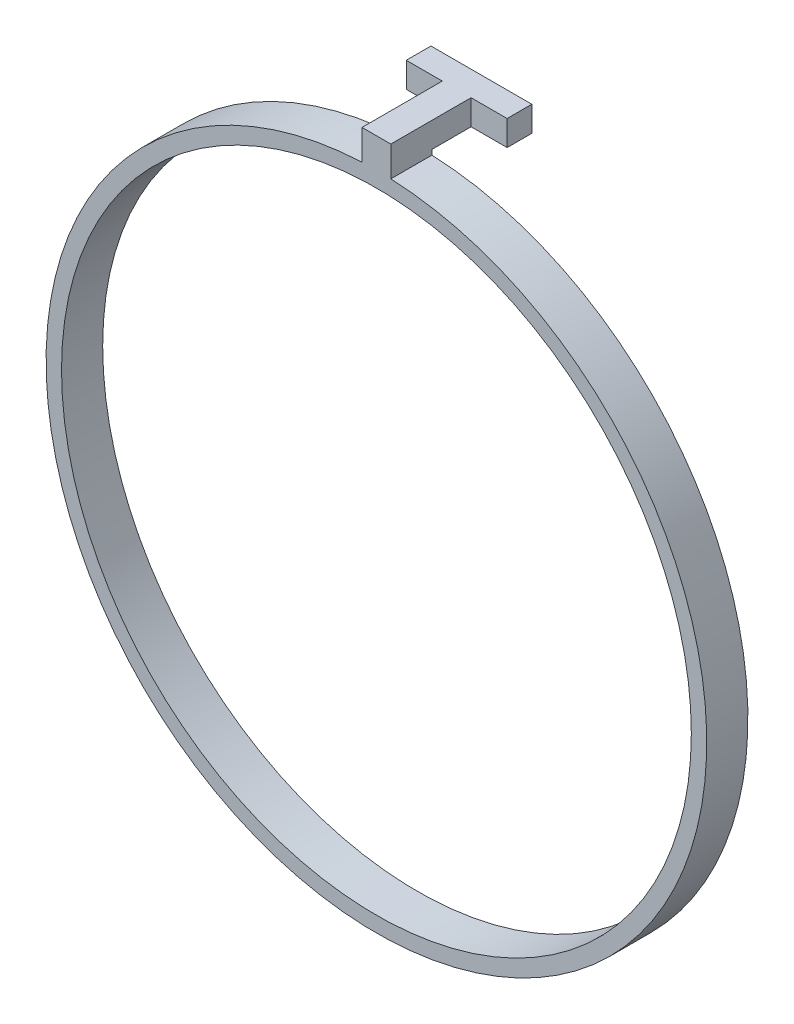
from build123d import *

# Parameters (mm, degrees)
SKETCH2_R           = 30.6
BOSS_EXTRUDE1_DEPTH = 4
SKETCH3_W           = 2.8
SKETCH3_H           = 2.45
BOSS_EXTRUDE2_DEPTH = 3.8
BOSS_EXTRUDE3_START = -6.3
SKETCH4_W           = 2.4
SKETCH4_H           = 2.45
BOSS_EXTRUDE3_DEPTH = 9.8


with BuildPart() as part:
    # Sketch2 → Boss-Extrude1 (new body)
    with BuildSketch(Plane.XY):
        with BuildLine():
            Line((-1.4, 35), (1.4, 35))
            Line((1.4, 35), (1.4, 32.069455873))
            ThreePointArc((1.4, 32.069455873), (0, -32.1), (-1.4, 32.069455873))
            Line((-1.4, 32.069455873), (-1.4, 35))
        make_face()
        Circle(SKETCH2_R, mode=Mode.SUBTRACT)
    extrude(amount=BOSS_EXTRUDE1_DEPTH)

    # Sketch3 → Boss-Extrude2 (add)
    with BuildSketch(Plane(origin=(0, 0, 0), x_dir=(-1, 0, 0), z_dir=(0, 0, -1))):
        with Locations((0, 33.775)):
            Rectangle(SKETCH3_W, SKETCH3_H)
    extrude(amount=BOSS_EXTRUDE2_DEPTH)

    # Sketch4 → Boss-Extrude3 (add)
    with BuildSketch(Plane(origin=(1.4, 0, 0), x_dir=(0, 0, -1), z_dir=(1, 0, 0)).offset(BOSS_EXTRUDE3_START)):
        with Locations((5, 33.775)):
            Rectangle(SKETCH4_W, SKETCH4_H)
    extrude(amount=BOSS_EXTRUDE3_DEPTH)


solid = part.part
